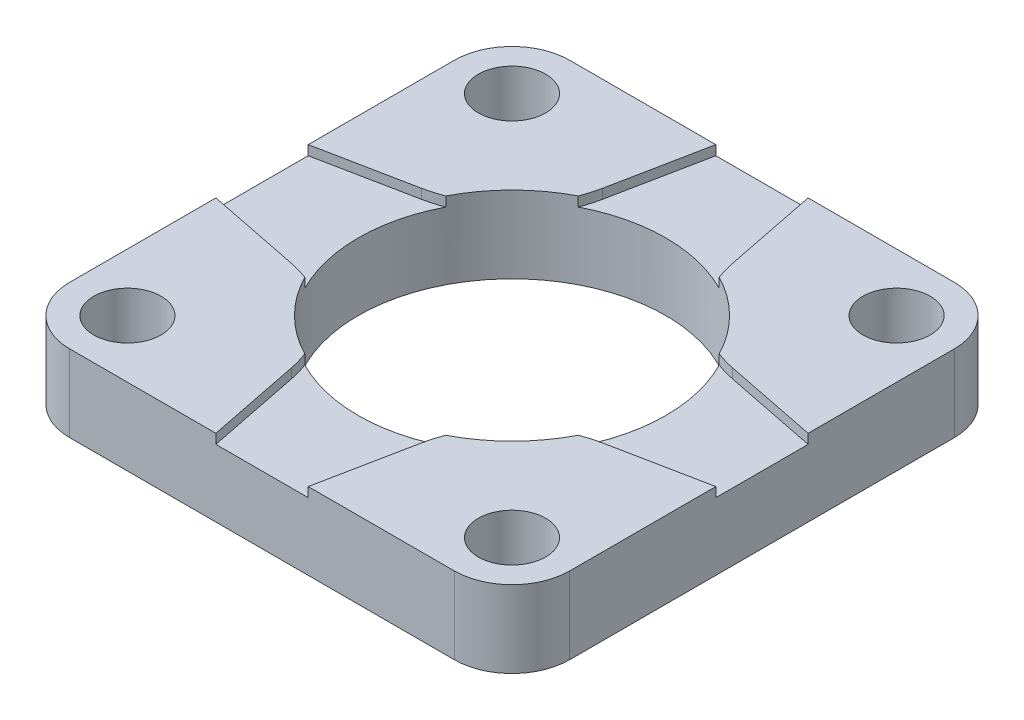
from build123d import *

# Parameters (mm, degrees)
SKETCH_2_R          = 8
SKETCH_2_R_2        = 1.75
EXTRUDE_1_DEPTH     = 4
CUT_EXTRUDE_START   = -0.5
CUT_EXTRUDE_1_DEPTH = 0.5


with BuildPart() as part:
    # 草图2 → 凸台-拉伸1 (new body)
    with BuildSketch(Plane(origin=(0, 0, 0), x_dir=(1, 0, 0), z_dir=(0, 1, 0))):
        with BuildLine():
            Line((-13, 10), (-13, -10))
            ThreePointArc((-13, -10), (-12.121320344, -12.121320344), (-10, -13))
            Line((-10, -13), (10, -13))
            ThreePointArc((10, -13), (12.121320344, -12.121320344), (13, -10))
            Line((13, -10), (13, 10))
            ThreePointArc((13, 10), (12.121320344, 12.121320344), (10, 13))
            Line((10, 13), (-10, 13))
            ThreePointArc((-10, 13), (-12.121320344, 12.121320344), (-13, 10))
        make_face()
        with Locations(Location((0, 0, 0), (0, 0, 270))):
            Circle(SKETCH_2_R, mode=Mode.SUBTRACT)
        with Locations(Location((-10, 10, 0), (0, 0, 270))):
            Circle(SKETCH_2_R_2, mode=Mode.SUBTRACT)
        with Locations(Location((10, 10, 0), (0, 0, 270))):
            Circle(SKETCH_2_R_2, mode=Mode.SUBTRACT)
        with Locations(Location((10, -10, 0), (0, 0, 270))):
            Circle(SKETCH_2_R_2, mode=Mode.SUBTRACT)
        with Locations(Location((-10, -10, 0), (0, 0, 270))):
            Circle(SKETCH_2_R_2, mode=Mode.SUBTRACT)
    extrude(amount=EXTRUDE_1_DEPTH)

    # 草图3 → 切除-拉伸1 (cut)
    with BuildSketch(Plane(origin=(0, 4, 0), x_dir=(1, 0, 0), z_dir=(0, 1, 0)).offset(CUT_EXTRUDE_START)):
        with BuildLine():
            ThreePointArc((-8.088989369, -3.382202126), (-7.593724303, -3.503347811), (-7.110532834, -3.666104584))
            ThreePointArc((-7.110532834, -3.666104584), (-8, 0), (-7.110532834, 3.666104584))
            ThreePointArc((-7.110532834, 3.666104584), (-7.593724303, 3.503347811), (-8.088989369, 3.382202126))
            Line((-8.088989369, 3.382202126), (-13, 2.4))
            Line((-13, 2.4), (-13, -2.4))
            Line((-13, -2.4), (-8.088989369, -3.382202126))
        make_face()
        with BuildLine():
            ThreePointArc((-3.382202126, 8.088989369), (-3.503347811, 7.593724303), (-3.666104584, 7.110532834))
            ThreePointArc((-3.666104584, 7.110532834), (0, 8), (3.666104584, 7.110532834))
            ThreePointArc((3.666104584, 7.110532834), (3.503347811, 7.593724303), (3.382202126, 8.088989369))
            Line((3.382202126, 8.088989369), (2.4, 13))
            Line((2.4, 13), (-2.4, 13))
            Line((-2.4, 13), (-3.382202126, 8.088989369))
        make_face()
        with BuildLine():
            ThreePointArc((8, 0), (7.774453764, -1.886231339), (7.110532834, -3.666104584))
            ThreePointArc((7.110532834, -3.666104584), (7.593724303, -3.503347811), (8.088989369, -3.382202126))
            Line((8.088989369, -3.382202126), (13, -2.4))
            Line((13, -2.4), (13, 2.4))
            Line((13, 2.4), (8.088989369, 3.382202126))
            ThreePointArc((8.088989369, 3.382202126), (7.593724303, 3.503347811), (7.110532834, 3.666104584))
            ThreePointArc((7.110532834, 3.666104584), (7.774453764, 1.886231339), (8, 0))
        make_face()
        with BuildLine():
            Line((0, -13), (0, -8))
            ThreePointArc((0, -8), (-1.886231339, -7.774453764), (-3.666104584, -7.110532834))
            ThreePointArc((-3.666104584, -7.110532834), (-3.503347811, -7.593724303), (-3.382202126, -8.088989369))
            Line((-3.382202126, -8.088989369), (-2.4, -13))
            Line((-2.4, -13), (0, -13))
        make_face()
        with BuildLine():
            ThreePointArc((3.666104584, -7.110532834), (1.886231339, -7.774453764), (0, -8))
            Line((0, -8), (0, -13))
            Line((0, -13), (2.4, -13))
            Line((2.4, -13), (3.382202126, -8.088989369))
            ThreePointArc((3.382202126, -8.088989369), (3.503347811, -7.593724303), (3.666104584, -7.110532834))
        make_face()
    extrude(amount=CUT_EXTRUDE_1_DEPTH, mode=Mode.SUBTRACT)


solid = part.part
